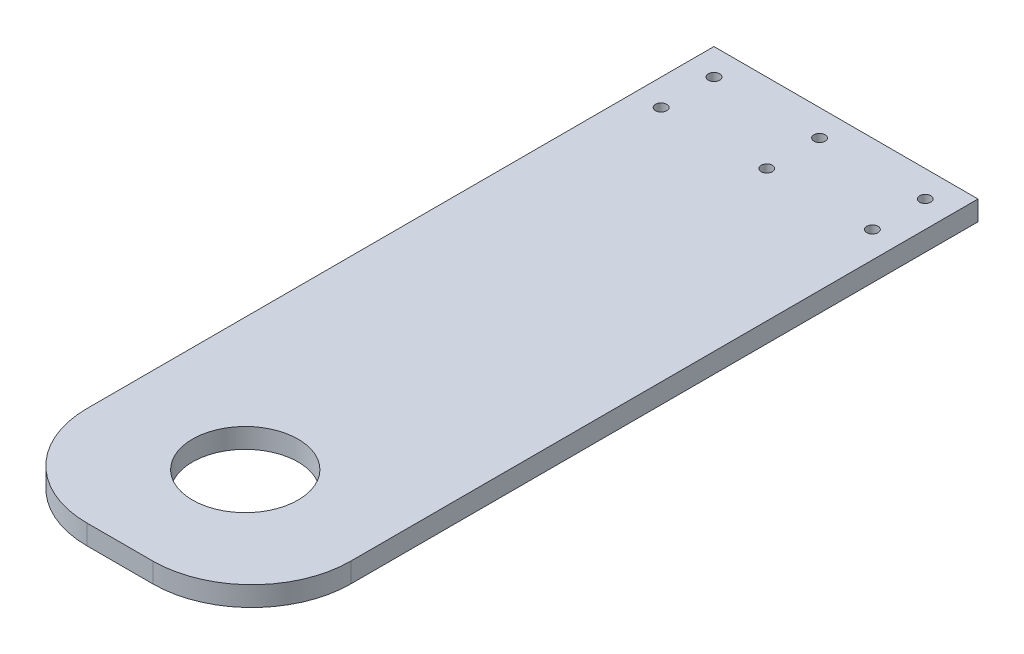
from build123d import *

# Parameters (mm, degrees)
SKETCH1_W                                           = 80
SKETCH1_H                                           = 230
BOSS_EXTRUDE1_DEPTH                                 = 6
F_32_0_32_DIAMETER_HOLE1_D                          = 32
FILLET1_R                                           = 30
CBORE_FOR_M3_HEX_SOCKET_HEAD_CAP_SCREW1_D           = 3.4
CBORE_FOR_M3_HEX_SOCKET_HEAD_CAP_SCREW1_CBORE_D     = 6.5
CBORE_FOR_M3_HEX_SOCKET_HEAD_CAP_SCREW1_CBORE_DEPTH = 3.4
SKETCH10_W                                          = 80
SKETCH10_H                                          = 10
CUT_EXTRUDE1_DEPTH                                  = 244.589819163


with BuildPart() as part:
    # Sketch1 → Boss-Extrude1 (new body)
    with BuildSketch(Plane(origin=(0, 0, 0), x_dir=(1, 0, 0), z_dir=(0, 1, 0))):
        with Locations((40, -115)):
            Rectangle(SKETCH1_W, SKETCH1_H)
    extrude(amount=BOSS_EXTRUDE1_DEPTH)

    # Ø32.0 (32) Diameter Hole1 (through all)
    with Locations(Plane(origin=(0, 6, 0), x_dir=(1, 0, 0), z_dir=(0, 1, 0))):
        with Locations((40, -192)):
            Hole(F_32_0_32_DIAMETER_HOLE1_D / 2)

    # Fillet1
    fillet1_edges = [part.edges().sort_by_distance(p)[0] for p in [
        (80, 3, 230),
        (0, 3, 230),
    ]]
    fillet(fillet1_edges, radius=FILLET1_R)

    # CBORE for M3 Hex Socket Head Cap Screw1 (through all)
    with Locations(Plane.XZ):
        with Locations((8, 18), (40, 18), (72, 18), (40, 34), (72, 34), (8, 34)):
            CounterBoreHole(CBORE_FOR_M3_HEX_SOCKET_HEAD_CAP_SCREW1_D / 2, CBORE_FOR_M3_HEX_SOCKET_HEAD_CAP_SCREW1_CBORE_D / 2, CBORE_FOR_M3_HEX_SOCKET_HEAD_CAP_SCREW1_CBORE_DEPTH)

    # Sketch10 → Cut-Extrude1 (cut, through all)
    with BuildSketch(Plane(origin=(0, 6, 0), x_dir=(1, 0, 0), z_dir=(0, 1, 0))):
        with Locations((40, -5)):
            Rectangle(SKETCH10_W, SKETCH10_H)
    extrude(amount=-CUT_EXTRUDE1_DEPTH, mode=Mode.SUBTRACT)


solid = part.part
